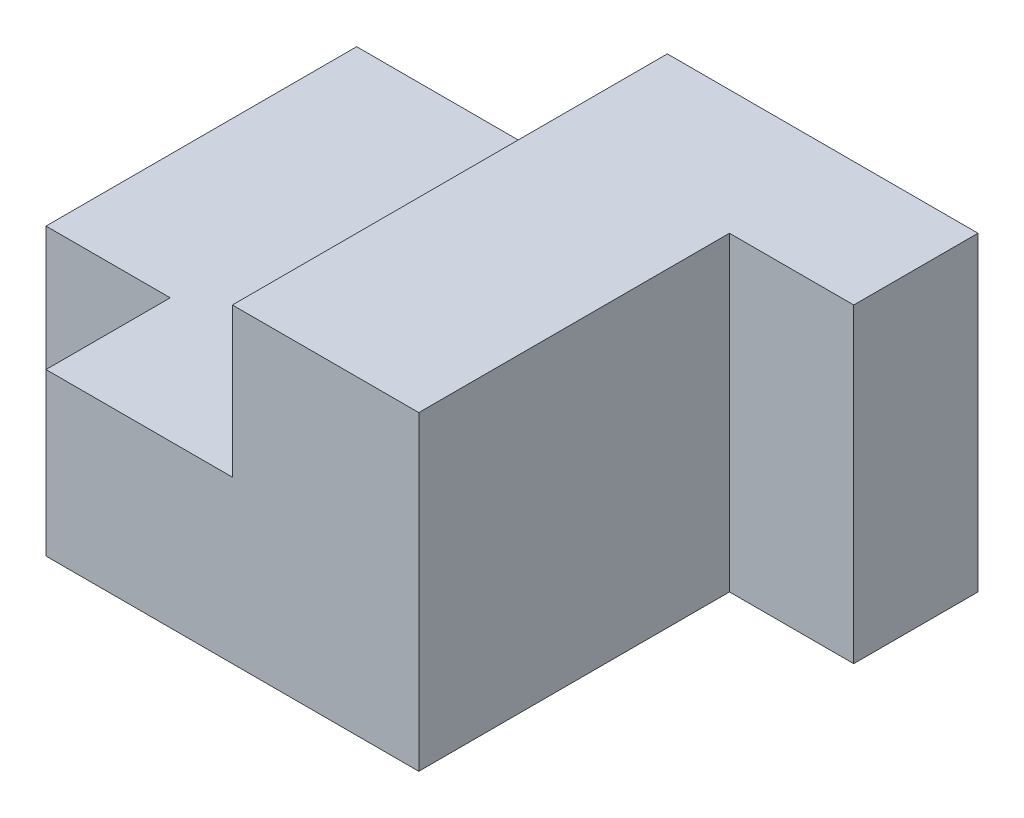
from build123d import *

# Parameters (mm, degrees)
BOSS_EXTRUDE1_DEPTH = 70
SKETCH2_W           = 20
SKETCH2_H           = 50
CUT_EXTRUDE1_DEPTH  = 50
SKETCH3_W           = 20
SKETCH3_H           = 26
CUT_EXTRUDE2_DEPTH  = 20


with BuildPart() as part:
    # Sketch1 → Boss-Extrude1 (new body)
    with BuildSketch(Plane.XY):
        Polygon((-33.026980357, 100.831089677), (-83.026980357, 100.831089677), (-83.026980357, 76.831089677), (-133.026980357, 76.831089677), (-133.026980357, 50.831089677), (-33.026980357, 50.831089677), align=None)
    extrude(amount=BOSS_EXTRUDE1_DEPTH)

    # Sketch2 → Cut-Extrude1 (cut)
    with BuildSketch(Plane.XY.offset(70)):
        with Locations((-43.026980357, 75.831089677)):
            Rectangle(SKETCH2_W, SKETCH2_H)
    extrude(amount=-CUT_EXTRUDE1_DEPTH, mode=Mode.SUBTRACT)

    # Sketch3 → Cut-Extrude2 (cut)
    with BuildSketch(Plane.XY.offset(70)):
        with Locations((-123.026980357, 63.831089677)):
            Rectangle(SKETCH3_W, SKETCH3_H)
    extrude(amount=-CUT_EXTRUDE2_DEPTH, mode=Mode.SUBTRACT)


solid = part.part
